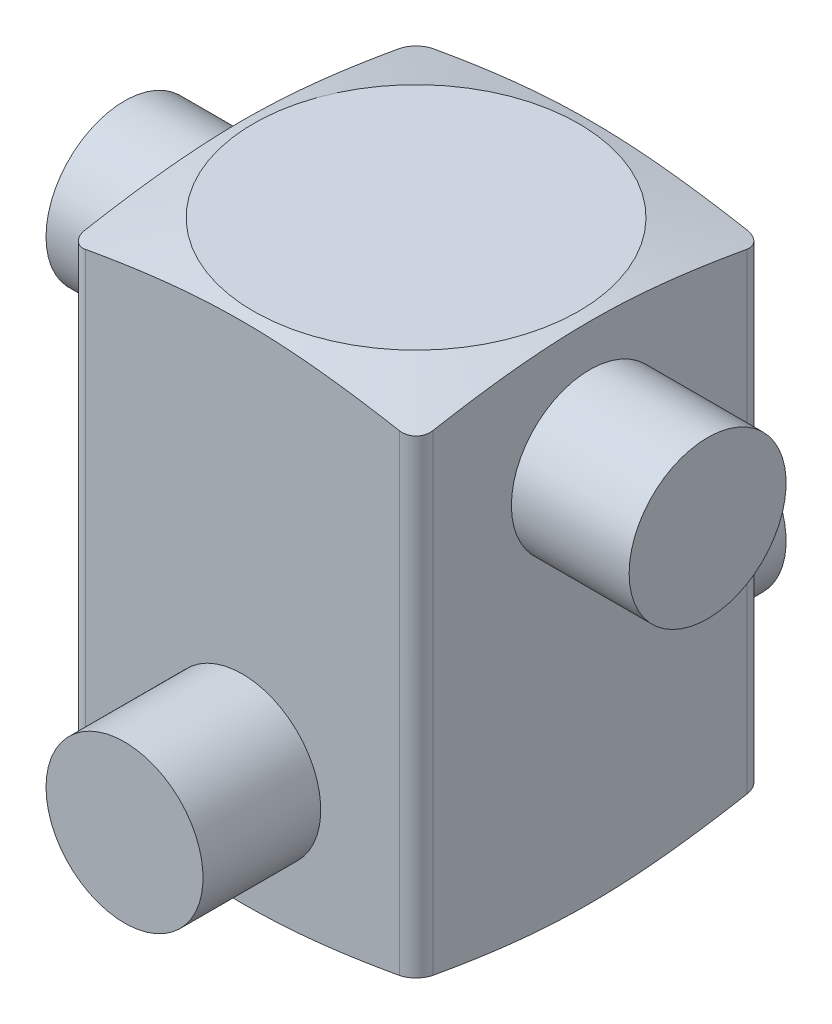
from build123d import *

# Parameters (mm, degrees)
INTERMEDIATE_BODY_SK_W  = 7.874
INTERMEDIATE_BODY_SK_H  = 7.874
INTERMEDIATE_BODY_DEPTH = 11.557
PIN1_R                  = 1.778
PIN_EXTRUDE1_DEPTH      = 6.604
PIN2_R                  = 1.778
PIN_EXTRUDE2_DEPTH      = 6.604
FILLET1_R               = 0.381


with BuildPart() as part:
    # Intermediate_Body-Sk → Intermediate_Body (new body)
    with BuildSketch(Plane(origin=(0, 0, 0), x_dir=(1, 0, 0), z_dir=(0, 1, 0))):
        Rectangle(INTERMEDIATE_BODY_SK_W, INTERMEDIATE_BODY_SK_H)
    extrude(amount=INTERMEDIATE_BODY_DEPTH)

    # Rev-CutSk → Cut-Revolve2 (revolve, cut)
    with BuildSketch(Plane.XY, mode=Mode.PRIVATE) as cut_revolve2_sk:
        Polygon((-3.683, 11.557), (-10.033, 9.855522628), (-10.033, 1.701477372), (-3.683, 0), (-12.573, 0), (-12.573, 11.557), align=None)
    revolve(cut_revolve2_sk.sketch.rotate(Axis((0, 0, 0), (0, 1, 0)), 180), axis=Axis((0, 0, 0), (0, 1, 0)), mode=Mode.SUBTRACT)

    # Pin1 → Pin-Extrude1 (add, symmetric)
    with BuildSketch(Plane.XY):
        with Locations(Location((0, 2.794, 0), (0, 0, 180))):
            Circle(PIN1_R)
    extrude(amount=PIN_EXTRUDE1_DEPTH, both=True)

    # Pin2 → Pin-Extrude2 (add, symmetric)
    with BuildSketch(Plane(origin=(0, 0, 0), x_dir=(0, 0, -1), z_dir=(1, 0, 0))):
        with Locations(Location((0, 8.763, 0), (0, 0, 180))):
            Circle(PIN2_R)
    extrude(amount=PIN_EXTRUDE2_DEPTH, both=True)

    # Fillet1
    fillet1_edges = [part.edges().sort_by_distance(p)[0] for p in [
        (3.937, 5.7785, -3.937),
        (-3.937, 5.7785, -3.937),
        (-3.937, 5.7785, 3.937),
        (3.937, 5.7785, 3.937),
    ]]
    fillet(fillet1_edges, radius=FILLET1_R)


solid = part.part
